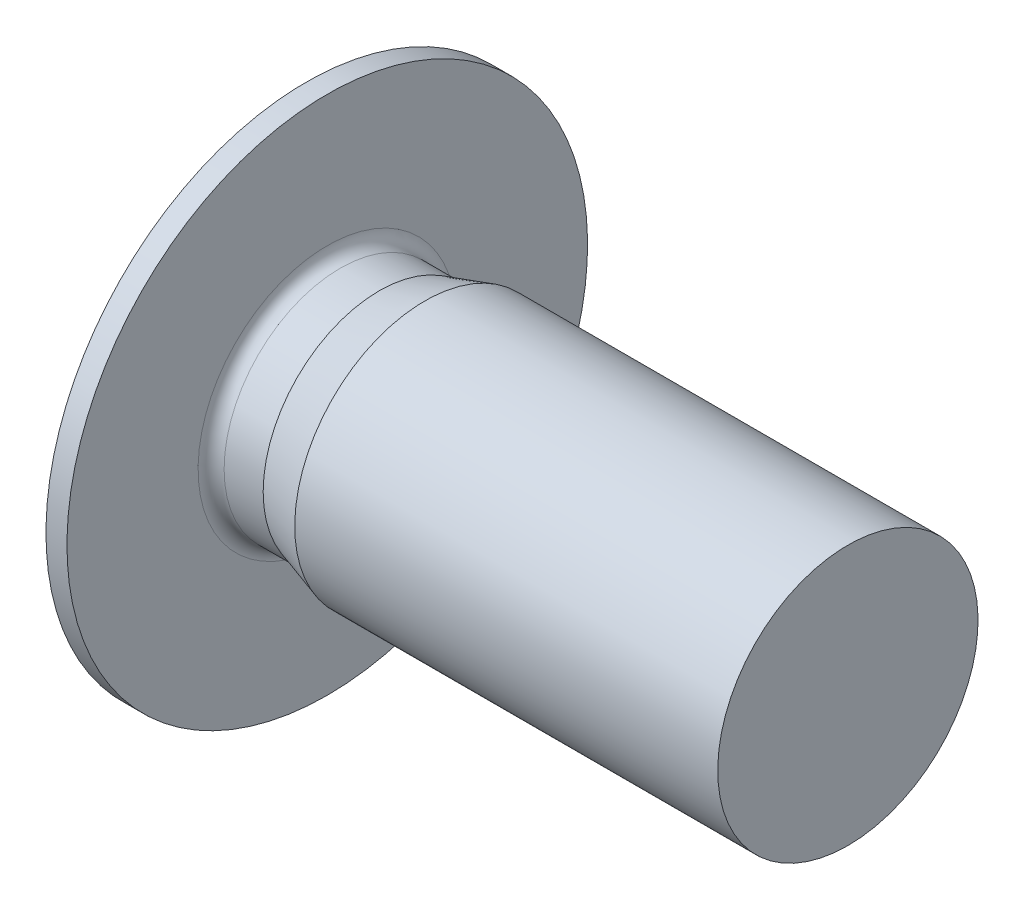
from build123d import *

# Parameters (mm, degrees)
FILLET1_R          = 0.2
CUT_EXTRUDE1_DEPTH = 2.5


with BuildPart() as part:
    # Sketch1 → Revolve1 (revolve)
    with BuildSketch(Plane.XY, mode=Mode.PRIVATE) as revolve1_sk:
        Polygon((-0.9, 0), (-0.9, 3), (-0.322649731, 4), (0, 4), (0, 1.785), (0.8, 1.785), (1.5, 2), (8, 2), (8, 0), align=None)
    revolve(revolve1_sk.sketch.rotate(Axis((-0.9, 0, 0), (1, 0, 0)), 180), axis=Axis((-0.9, 0, 0), (1, 0, 0)))

    # Fillet1
    fillet1_edges = [part.edges().sort_by_distance(p)[0] for p in [
        (0, 1.785, 0),
    ]]
    fillet(fillet1_edges, radius=FILLET1_R)

    # Sketch2 → Cut-Extrude1 (cut)
    with BuildSketch(Plane.ZY.offset(0.9)):
        Polygon((0, 1.154700538), (-1, 0.577350269), (-1, -0.577350269), (0, -1.154700538), (1, -0.577350269), (1, 0.577350269), align=None)
    extrude(amount=-CUT_EXTRUDE1_DEPTH, mode=Mode.SUBTRACT)

    # Sketch3 → Cut-Revolve1 (revolve, cut)
    with BuildSketch(Plane.XY, mode=Mode.PRIVATE) as cut_revolve1_sk:
        Polygon((1.6, 0), (1.6, 1), (2.200860619, 0), align=None)
    revolve(cut_revolve1_sk.sketch.rotate(Axis((1.6, 0, 0), (1, 0, 0)), 180), axis=Axis((1.6, 0, 0), (1, 0, 0)), mode=Mode.SUBTRACT)


solid = part.part
